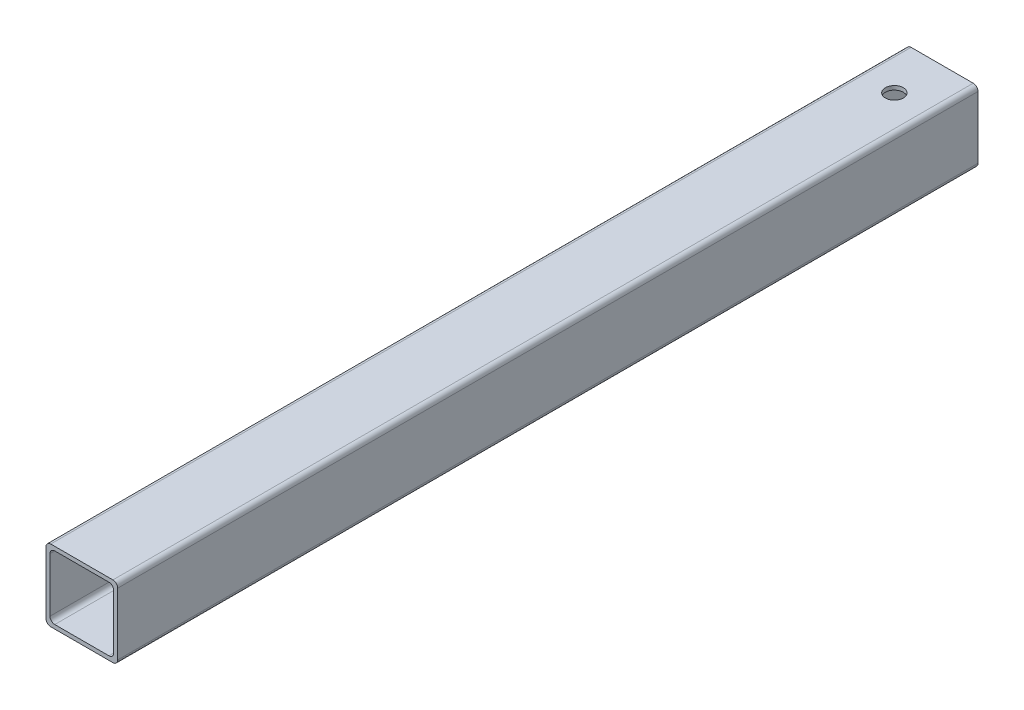
from build123d import *

# Parameters (mm, degrees)
SKETCH1_W           = 38.1
SKETCH1_H           = 38.1
SKETCH1_W_2         = 33.8836
SKETCH1_H_2         = 33.8836
BOSS_EXTRUDE1_DEPTH = 457.2
FILLET1_R           = 2.54
SKETCH2_R           = 4.7625
CUT_EXTRUDE1_DEPTH  = 460.180087221


with BuildPart() as part:
    # Sketch1 → Boss-Extrude1 (new body)
    with BuildSketch(Plane.XY):
        Rectangle(SKETCH1_W, SKETCH1_H)
        Rectangle(SKETCH1_W_2, SKETCH1_H_2, mode=Mode.SUBTRACT)
    extrude(amount=BOSS_EXTRUDE1_DEPTH)

    # Fillet1
    fillet1_edges = [part.edges().sort_by_distance(p)[0] for p in [
        (19.05, -19.05, 228.6),
        (16.9418, -16.9418, 228.6),
        (16.9418, 16.9418, 228.6),
        (19.05, 19.05, 228.6),
        (-16.9418, 16.9418, 228.6),
        (-19.05, 19.05, 228.6),
        (-16.9418, -16.9418, 228.6),
        (-19.05, -19.05, 228.6),
    ]]
    fillet(fillet1_edges, radius=FILLET1_R)

    # Sketch2 → Cut-Extrude1 (cut, through all)
    with BuildSketch(Plane(origin=(0, 19.05, 0), x_dir=(1, 0, 0), z_dir=(0, 1, 0))):
        with Locations((0, -25.4)):
            Circle(SKETCH2_R)
    extrude(amount=-CUT_EXTRUDE1_DEPTH, mode=Mode.SUBTRACT)


solid = part.part
